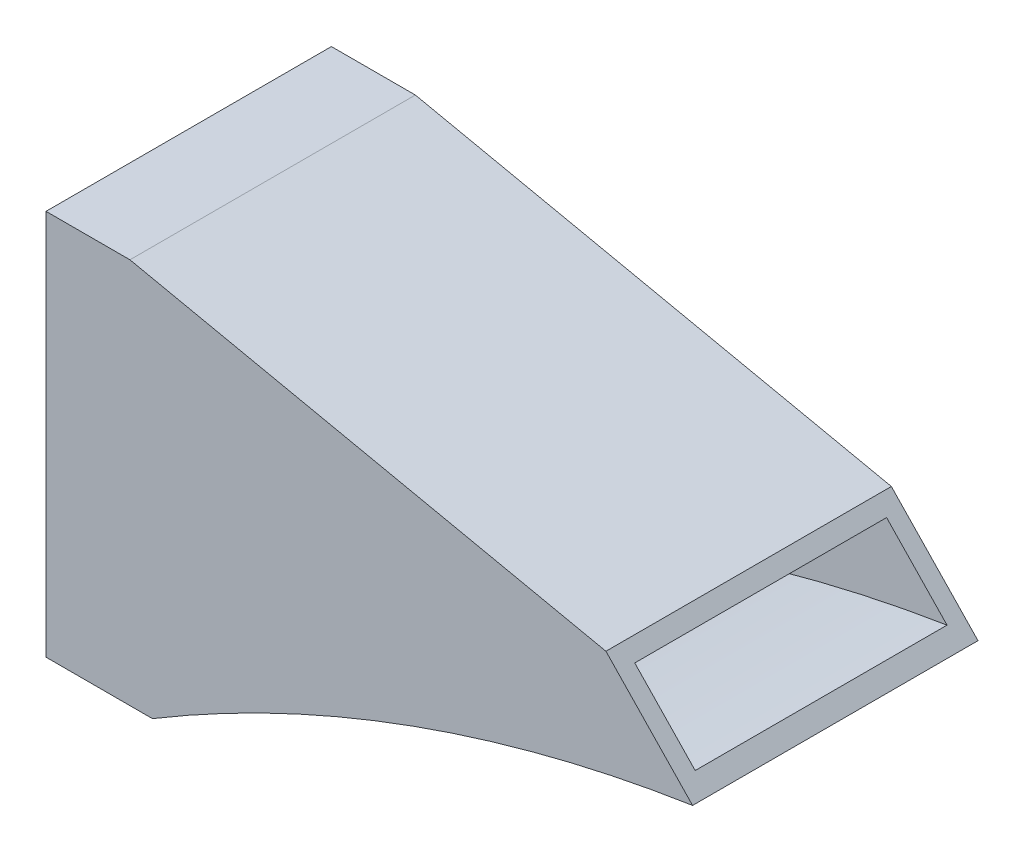
from build123d import *

# Parameters (mm, degrees)
BOSS_EXTRUDE3_START = 1
BOSS_EXTRUDE3_DEPTH = 17
CUT_EXTRUDE1_START  = -1
CUT_EXTRUDE1_DEPTH  = 15


with BuildPart() as part:
    # Sketch1 → Boss-Extrude3 (new body)
    with BuildSketch(Plane.XY.offset(BOSS_EXTRUDE3_START)):
        with BuildLine():
            Line((22.4, 5.7), (22.4, 28.7))
            Line((22.4, 28.7), (27.4, 28.7))
            Line((27.4, 28.7), (55.753018587, 22.683636365))
            Line((55.753018587, 22.683636365), (60.914628912, 17.309586353))
            ThreePointArc((60.914628912, 17.309586353), (44.261162639, 13.072852444), (28.739278089, 5.7))
            Line((28.739278089, 5.7), (22.4, 5.7))
        make_face()
    extrude(amount=-BOSS_EXTRUDE3_DEPTH)

    # Sketch2 → Cut-Extrude1 (cut)
    with BuildSketch(Plane.XY.offset(1).offset(CUT_EXTRUDE1_START)):
        with BuildLine():
            Line((22.4, 6.7), (28.46302932, 6.7))
            ThreePointArc((28.46302932, 6.7), (43.722391124, 13.941290059), (60.06988402, 18.189098949))
            Line((60.06988402, 18.189098949), (56.469277883, 21.937897528))
            Line((56.469277883, 21.937897528), (54.449845351, 21.937897528))
            Line((54.449845351, 21.937897528), (27.295070739, 27.7))
            Line((27.295070739, 27.7), (22.4, 27.7))
            Line((22.4, 27.7), (22.4, 6.7))
        make_face()
    extrude(amount=-CUT_EXTRUDE1_DEPTH, mode=Mode.SUBTRACT)


solid = part.part
